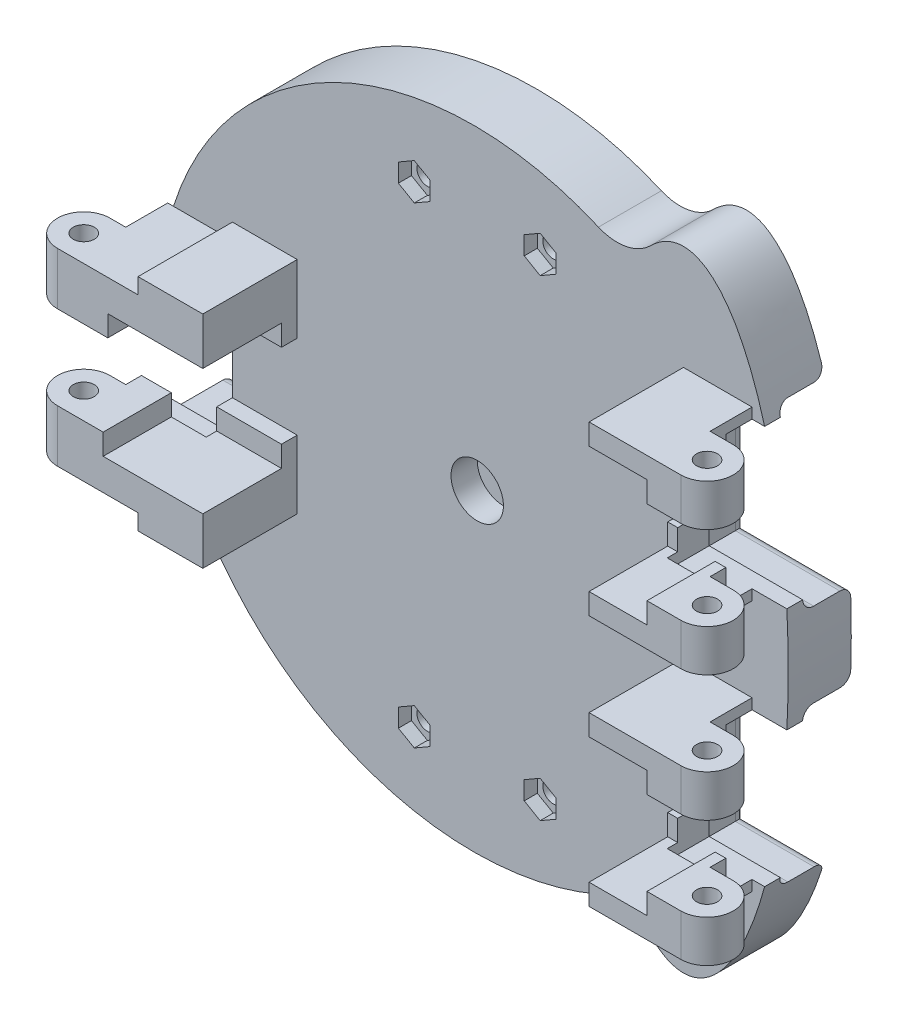
from build123d import *

# Parameters (mm, degrees)
BOSS_EXTRUDE1_DEPTH = 12
SKETCH3_R           = 5
CUT_EXTRUDE1_DEPTH  = 5
CUT_EXTRUDE2_DEPTH  = 2.5
BOSS_EXTRUDE2_DEPTH = 18
BOSS_EXTRUDE3_DEPTH = 18
SKETCH11_R          = 2
CUT_EXTRUDE5_DEPTH  = 20
CUT_EXTRUDE13_DEPTH = 12
SKETCH16_R          = 2
CUT_EXTRUDE14_DEPTH = 90
CUT_EXTRUDE15_DEPTH = 81
CUT_EXTRUDE19_DEPTH = 9
CUT_EXTRUDE22_DEPTH = 3
SKETCH22_W          = 18.109533767
SKETCH22_H          = 4
SKETCH22_W_2        = 19
SKETCH22_W_3        = 11.04280637
CUT_EXTRUDE23_DEPTH = 15
FILLET3_R           = 2
FILLET4_R           = 2
FILLET5_R           = 2
CUT_EXTRUDE24_DEPTH = 3.5
SKETCH24_R          = 2
CUT_EXTRUDE25_DEPTH = 40
CUT_EXTRUDE26_DEPTH = 40
CUT_EXTRUDE27_DEPTH = 110
CUT_EXTRUDE28_DEPTH = 90
CUT_EXTRUDE29_DEPTH = 40
SKETCH31_W          = 12.343808583
SKETCH31_H          = 28
SKETCH31_W_2        = 17.813146094
CUT_EXTRUDE31_DEPTH = 17


with BuildPart() as part:
    # Sketch1 → Boss-Extrude1 (new body)
    with BuildSketch(Plane(origin=(0, 0, 0), x_dir=(0, 1, 0), z_dir=(0, 0, 1))):
        with BuildLine():
            ThreePointArc((55.078779174, 16.202351278), (0, 100), (-55.078779174, 16.202351278))
            ThreePointArc((-55.078779174, 16.202351278), (-54.497842346, 10.957679515), (-56.956636983, 6.288804016))
            add(Edge.make_bspline(
                [(-56.956636983, 6.288804016), (-83.080479703, -20), (0, -20), (83.080479703, -20), (56.956636983, 6.288804016)],
                knots=[2.821725768, 2.821725768, 2.821725768, 4.71238898, 4.71238898, 6.603052193, 6.603052193, 6.603052193], degree=2, weights=[1, 0.585474081, 1, 0.585474081, 1]))
            ThreePointArc((56.956636983, 6.288804016), (54.497842346, 10.957679515), (55.078779174, 16.202351278))
        make_face()
    extrude(amount=BOSS_EXTRUDE1_DEPTH)

    # Sketch3 → Cut-Extrude1 (cut)
    with BuildSketch(Plane.XY.offset(12)):
        with Locations((-39.325887817, 0)):
            Circle(SKETCH3_R)
    extrude(amount=-CUT_EXTRUDE1_DEPTH, mode=Mode.SUBTRACT)

    # Sketch4 → Cut-Extrude2 (cut)
    with BuildSketch(Plane.XY.offset(12)):
        Polygon((-51.325887817, 41.5), (-48.294798904, 43.25), (-48.294798904, 46.75), (-51.325887817, 48.5), (-54.35697673, 46.75), (-54.35697673, 43.25), align=None)
        Polygon((-27.325887817, 41.5), (-24.294798904, 43.25), (-24.294798904, 46.75), (-27.325887817, 48.5), (-30.35697673, 46.75), (-30.35697673, 43.25), align=None)
        Polygon((-51.325887817, -48.5), (-48.294798904, -46.75), (-48.294798904, -43.25), (-51.325887817, -41.5), (-54.35697673, -43.25), (-54.35697673, -46.75), align=None)
        Polygon((-27.325887817, -48.5), (-24.294798904, -46.75), (-24.294798904, -43.25), (-27.325887817, -41.5), (-30.35697673, -43.25), (-30.35697673, -46.75), align=None)
    extrude(amount=-CUT_EXTRUDE2_DEPTH, mode=Mode.SUBTRACT)

    # Sketch5 → Boss-Extrude2 (add)
    with BuildSketch(Plane.XY.offset(12)):
        Polygon((-100, 8), (-86, 8), (-73.64976778, 8), (-73.64976778, 16), (-73.64976778, 21), (-86, 21), (-86, 17.988215932), (-117, 17.988215932), (-117, 8), (-105, 8), align=None)
        Polygon((-100, -8), (-86, -8), (-73.64976778, -8), (-73.64976778, -16), (-73.64976778, -21), (-86, -21), (-86, -17.992894417), (-117, -17.992894417), (-117, -8), (-105, -8), align=None)
    extrude(amount=BOSS_EXTRUDE2_DEPTH)

    # Sketch6 → Boss-Extrude3 (add)
    with BuildSketch(Plane.XY.offset(12)):
        Polygon((20, 40), (0, 40), (0, 32), (20, 32), (30, 32), (30, 40), align=None)
        Polygon((20, 8), (0, 8), (0, 16), (20, 16), (30, 16), (30, 8), align=None)
        Polygon((20, -16), (0, -16), (0, -8), (20, -8), (30, -8), (30, -16), align=None)
        Polygon((20, -40), (0, -40), (0, -32), (18.7036013, -32), (30, -32), (30, -40), align=None)
    extrude(amount=BOSS_EXTRUDE3_DEPTH)

    # Sketch11 → Cut-Extrude5 (cut)
    with BuildSketch(Plane.XY.offset(12)):
        with Locations((-51.325887817, 45)):
            Circle(SKETCH11_R)
        with Locations((-51.325887817, -45)):
            Circle(SKETCH11_R)
        with Locations((-27.325887817, -45)):
            Circle(SKETCH11_R)
        with Locations((-27.325887817, 45)):
            Circle(SKETCH11_R)
    extrude(amount=-CUT_EXTRUDE5_DEPTH, mode=Mode.SUBTRACT)

    # Sketch14 → Cut-Extrude13 (cut)
    with BuildSketch(Plane(origin=(0, 0, 0), x_dir=(1, 0, 0), z_dir=(0, 0, -1))):
        with BuildLine():
            Line((-86, 0), (-86, 14))
            Line((-86, 14), (-86, 16))
            Line((-86, 16), (-97.827329179, 16))
            ThreePointArc((-97.827329179, 16), (-100, 0), (-97.827329179, -16))
            Line((-97.827329179, -16), (-86, -16))
            Line((-86, -16), (-86, -14))
            Line((-86, -14), (-86, 0))
        make_face()
    extrude(amount=-CUT_EXTRUDE13_DEPTH, mode=Mode.SUBTRACT)

    # Sketch16 → Cut-Extrude14 (cut)
    with BuildSketch(Plane.XZ.offset(40)):
        with Locations((17.5, 25)):
            Circle(SKETCH16_R)
    extrude(amount=-CUT_EXTRUDE14_DEPTH, mode=Mode.SUBTRACT)

    # Sketch17 → Cut-Extrude15 (cut)
    with BuildSketch(Plane.XZ.offset(40)):
        with BuildLine():
            Line((17.5, 30), (30, 30))
            Line((30, 30), (30, 20))
            Line((30, 20), (17.5, 20))
            ThreePointArc((17.5, 20), (22.5, 25), (17.5, 30))
        make_face()
    extrude(amount=-CUT_EXTRUDE15_DEPTH, mode=Mode.SUBTRACT)

    # Sketch20 → Cut-Extrude19 (cut)
    with BuildSketch(Plane(origin=(0, 0, 0), x_dir=(1, 0, 0), z_dir=(0, 0, -1))):
        with BuildLine():
            Line((14.90711985, 40), (-0.09288015, 40))
            Line((-0.09288015, 40), (-0.09288015, 8))
            Line((-0.09288015, 8), (19.821424996, 8))
            add(Edge.make_bspline(
                [(19.821424996, 8), (19.002374139, 26.264099538), (14.90711985, 40)],
                knots=[4.84612057, 4.84612057, 4.84612057, 5.442116637, 5.442116637, 5.442116637], degree=2, weights=[1, 0.955926196, 1]))
        make_face()
        with BuildLine():
            Line((14.90711985, -40), (-0.09288015, -40))
            Line((-0.09288015, -40), (-0.09288015, -8))
            Line((-0.09288015, -8), (19.821424996, -8))
            add(Edge.make_bspline(
                [(14.90711985, -40), (19.002374139, -26.264099538), (19.821424996, -8)],
                knots=[3.982661324, 3.982661324, 3.982661324, 4.578657391, 4.578657391, 4.578657391], degree=2, weights=[1, 0.955926196, 1]))
        make_face()
    extrude(amount=-CUT_EXTRUDE19_DEPTH, mode=Mode.SUBTRACT)

    # Sketch21 → Cut-Extrude22 (cut)
    with BuildSketch(Plane(origin=(0, 0, 9), x_dir=(1, 0, 0), z_dir=(0, 0, -1))):
        with BuildLine():
            Line((16.602908143, 33.452817085), (3.290516265, 33.452817085))
            Line((3.290516265, 33.452817085), (3.290516265, 14.072091821))
            Line((3.290516265, 14.072091821), (19.442154178, 14.072091821))
            add(Edge.make_bspline(
                [(19.442154178, 14.072091821), (18.601455441, 24.525757993), (16.602908143, 33.452817085)],
                knots=[4.949129039, 4.949129039, 4.949129039, 5.303816875, 5.303816875, 5.303816875], degree=2, weights=[1, 0.984315739, 1]))
        make_face()
        with BuildLine():
            Line((19.428514971, -14.240619867), (3.290516265, -14.240619867))
            Line((3.290516265, -14.240619867), (3.290516265, -34.126929268))
            Line((3.290516265, -34.126929268), (16.449764263, -34.126929268))
            add(Edge.make_bspline(
                [(16.449764263, -34.126929268), (18.551496034, -25.009292952), (19.428514971, -14.240619867)],
                knots=[4.107364569, 4.107364569, 4.107364569, 4.472758518, 4.472758518, 4.472758518], degree=2, weights=[1, 0.983357277, 1]))
        make_face()
    extrude(amount=-CUT_EXTRUDE22_DEPTH, mode=Mode.SUBTRACT)

    # Sketch22 → Cut-Extrude23 (cut)
    with BuildSketch(Plane.XY.offset(30)):
        with Locations((-82.704534663, 10)):
            Rectangle(SKETCH22_W, SKETCH22_H)
        with Locations((-83.14976778, -10)):
            Rectangle(SKETCH22_W_2, SKETCH22_H)
        with Locations((5.521403185, 34)):
            Rectangle(SKETCH22_W_3, SKETCH22_H)
        with Locations((5.521403185, 14)):
            Rectangle(SKETCH22_W_3, SKETCH22_H)
        with Locations((5.521403185, -14)):
            Rectangle(SKETCH22_W_3, SKETCH22_H)
        with Locations((5.521403185, -34)):
            Rectangle(SKETCH22_W_3, SKETCH22_H)
    extrude(amount=-CUT_EXTRUDE23_DEPTH, mode=Mode.SUBTRACT)

    # Fillet3
    fillet3_edges = [part.edges().sort_by_distance(p)[0] for p in [
        (9.946712204, -33.452817085, 9),
        (11.366335222, -14.072091821, 9),
        (11.359515618, 14.240619867, 9),
        (9.870140264, 34.126929268, 9),
    ]]
    fillet(fillet3_edges, radius=FILLET3_R)

    # Fillet4
    fillet4_edges = [part.edges().sort_by_distance(p)[0] for p in [
        (-91.91366459, 16, 12),
        (-91.91366459, -16, 12),
        (7.40711985, 40, 9),
        (-0.09288015, 24, 9),
        (9.864272423, 8, 9),
        (-0.09288015, -24, 9),
        (7.40711985, -40, 9),
        (9.864272423, -8, 9),
    ]]
    fillet(fillet4_edges, radius=FILLET4_R)

    # Fillet5
    fillet5_edges = [part.edges().sort_by_distance(p)[0] for p in [
        (-91.91366459, 16, 0),
        (-86, 0, 0),
        (-91.91366459, -16, 0),
        (7.40711985, -40, 0),
        (-0.09288015, -24, 0),
        (9.864272423, -8, 0),
        (9.864272423, 8, 0),
        (-0.09288015, 24, 0),
        (7.40711985, 40, 0),
    ]]
    fillet(fillet5_edges, radius=FILLET5_R)

    # Sketch23 → Cut-Extrude24 (cut)
    with BuildSketch(Plane(origin=(0, 0, 0), x_dir=(1, 0, 0), z_dir=(0, 0, -1))):
        Polygon((-27.325887817, 49.4), (-31.136399594, 47.2), (-31.136399594, 42.8), (-27.325887817, 40.6), (-23.51537604, 42.8), (-23.51537604, 47.2), align=None)
        Polygon((-51.325887817, 49.4), (-55.136399594, 47.2), (-55.136399594, 42.8), (-51.325887817, 40.6), (-47.51537604, 42.8), (-47.51537604, 47.2), align=None)
        Polygon((-27.325887817, -49.4), (-23.51537604, -47.2), (-23.51537604, -42.8), (-27.325887817, -40.6), (-31.136399594, -42.8), (-31.136399594, -47.2), align=None)
        Polygon((-51.325887817, -49.4), (-47.51537604, -47.2), (-47.51537604, -42.8), (-51.325887817, -40.6), (-55.136399594, -42.8), (-55.136399594, -47.2), align=None)
    extrude(amount=-CUT_EXTRUDE24_DEPTH, mode=Mode.SUBTRACT)

    # Sketch24 → Cut-Extrude25 (cut)
    with BuildSketch(Plane(origin=(0, 17.988215932, 0), x_dir=(-1, 0, 0), z_dir=(0, 1, 0))):
        with Locations((101.35, 25)):
            Circle(SKETCH24_R)
    extrude(amount=-CUT_EXTRUDE25_DEPTH, mode=Mode.SUBTRACT)

    # Sketch25 → Cut-Extrude26 (cut)
    with BuildSketch(Plane(origin=(0, 17.988215932, 0), x_dir=(-1, 0, 0), z_dir=(0, 1, 0))):
        Polygon((98.343808583, 12), (98.343808583, 18.170183119), (109.600792371, 18.170183119), (109.600792371, 30), (117, 30), (117, 12), align=None)
    extrude(amount=-CUT_EXTRUDE26_DEPTH, mode=Mode.SUBTRACT)

    # Sketch27 → Cut-Extrude27 (cut)
    with BuildSketch(Plane(origin=(0, 40, 0), x_dir=(-1, 0, 0), z_dir=(0, 1, 0))):
        Polygon((-17.5, 20), (-14.90711985, 12), (-30, 12), (-30, 20), align=None)
    extrude(amount=-CUT_EXTRUDE27_DEPTH, mode=Mode.SUBTRACT)

    # Sketch28 → Cut-Extrude28 (cut)
    with BuildSketch(Plane(origin=(0, 40, 0), x_dir=(-1, 0, 0), z_dir=(0, 1, 0))):
        Polygon((-17.5, 20), (-13.077809334, 20), (-13.077809334, 12), (-14.90711985, 12), align=None)
    extrude(amount=-CUT_EXTRUDE28_DEPTH, mode=Mode.SUBTRACT)

    # Sketch29 → Cut-Extrude29 (cut)
    with BuildSketch(Plane(origin=(0, 17.988215932, 0), x_dir=(-1, 0, 0), z_dir=(0, 1, 0))):
        with BuildLine():
            Line((98.343808583, 18.170183119), (98.343808583, 20))
            Line((98.343808583, 20), (101.35, 20))
            ThreePointArc((101.35, 20), (106.35, 25), (101.35, 30))
            Line((101.35, 30), (109.600792371, 30))
            Line((109.600792371, 30), (109.600792371, 18.170183119))
            Line((109.600792371, 18.170183119), (98.343808583, 18.170183119))
        make_face()
    extrude(amount=-CUT_EXTRUDE29_DEPTH, mode=Mode.SUBTRACT)

    # Sketch31 → Cut-Extrude31 (cut)
    with BuildSketch(Plane(origin=(0, 0, 0), x_dir=(1, 0, 0), z_dir=(0, 0, -1))):
        with Locations((-92.171904291, 0)):
            Rectangle(SKETCH31_W, SKETCH31_H)
        Polygon((1.90711985, 38), (15.477582355, 38), (19.720265944, 38), (19.720265944, 10), (1.90711985, 10), align=None)
        with Locations((10.813692897, -24)):
            Rectangle(SKETCH31_W_2, SKETCH31_H)
    extrude(amount=-CUT_EXTRUDE31_DEPTH, mode=Mode.SUBTRACT)


solid = part.part
